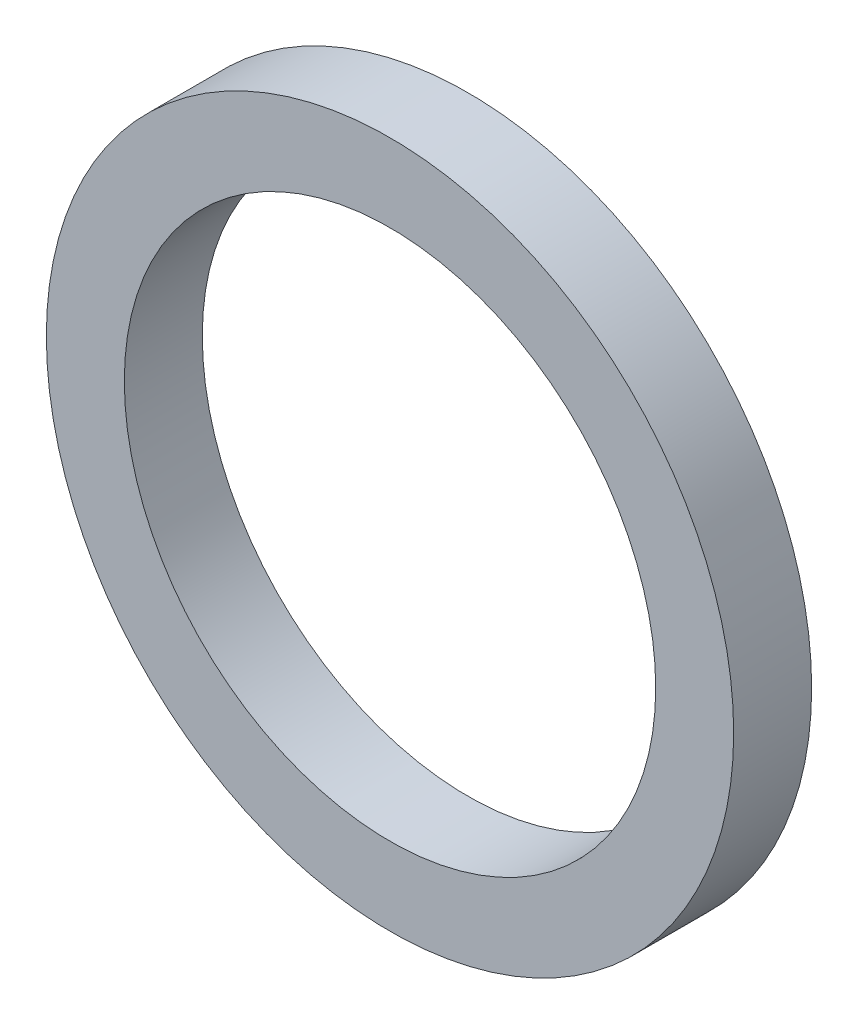
from build123d import *

# Parameters (mm, degrees)
SKETCH1_W = 1.5875
SKETCH1_H = 1.5875


with BuildPart() as part:
    # Sketch1 → Revolve1 (revolve)
    with BuildSketch(Plane(origin=(0, 0, 0), x_dir=(1, 0, 0), z_dir=(0, 1, 0))):
        with Locations((6.20395, -0.15875)):
            Rectangle(SKETCH1_W, SKETCH1_H)
    revolve(axis=Axis((0, 0, 0.635), (0, 0, -1)))


solid = part.part
